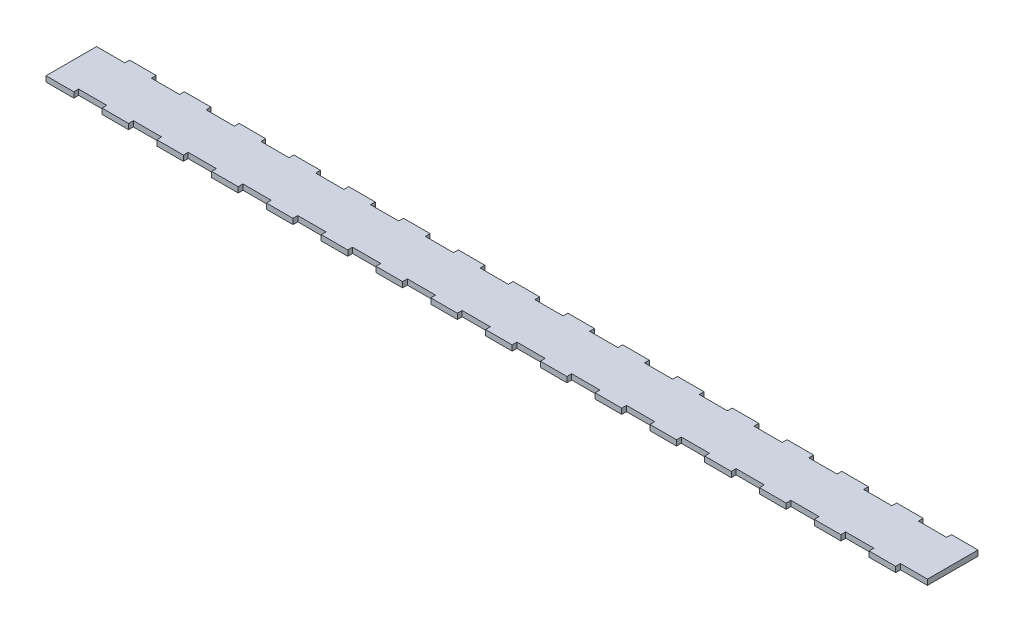
from build123d import *

# Parameters (mm, degrees)
SKETCH1_W           = 640
SKETCH1_H           = 40.4
BOSS_EXTRUDE1_DEPTH = 4
SKETCH2_W           = 20.6
SKETCH2_H           = 3.5
CUT_EXTRUDE1_DEPTH  = 4
LPATTERN1_COUNT     = 17
LPATTERN1_PITCH     = 40


with BuildPart() as part:
    # Sketch1 → Boss-Extrude1 (new body)
    with BuildSketch(Plane(origin=(0, 0, 0), x_dir=(1, 0, 0), z_dir=(0, 1, 0))):
        Rectangle(SKETCH1_W, SKETCH1_H)
    extrude(amount=BOSS_EXTRUDE1_DEPTH)

    # Sketch2 → Cut-Extrude1 (cut)
    with BuildSketch(Plane(origin=(0, 4, 0), x_dir=(1, 0, 0), z_dir=(0, 1, 0))):
        with Locations((-309.7, 18.45)):
            Rectangle(SKETCH2_W, SKETCH2_H)
        with Locations((-289.4, -18.45)):
            Rectangle(SKETCH2_W, SKETCH2_H)
    cut_extrude1 = extrude(amount=-CUT_EXTRUDE1_DEPTH, mode=Mode.SUBTRACT)

    # LPattern1: Cut-Extrude1 ×17
    with Locations(*[(i * LPATTERN1_PITCH, 0, 0) for i in range(1, LPATTERN1_COUNT)]):
        add(cut_extrude1, mode=Mode.SUBTRACT)


solid = part.part
